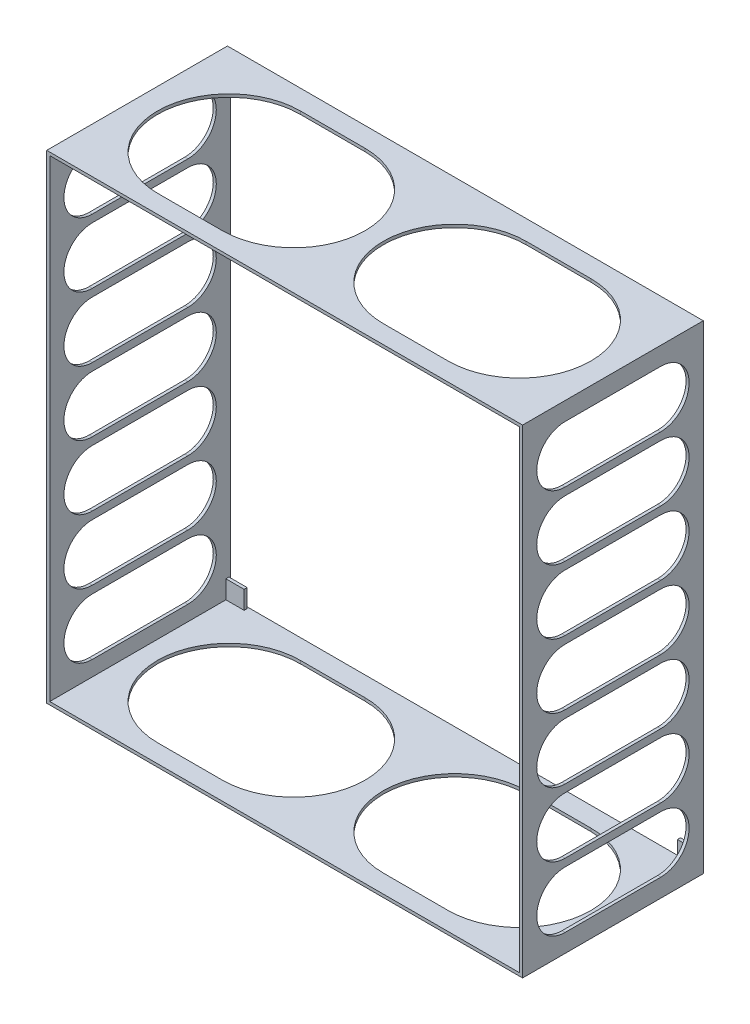
from build123d import *

# Parameters (mm, degrees)
SKETCH1_W               = 313.367
SKETCH1_H               = 315.36
SKETCH1_W_2             = 309.367
SKETCH1_H_2             = 311.36
EXTRUDE_THIN1_DEPTH     = 119
CUT_EXTRUDE1_DEPTH      = 445.128605574
CUT_EXTRUDE1_DEPTH_BACK = 445.128605574
SKETCH3_W               = 2
SKETCH3_H               = 12
BOSS_EXTRUDE1_DEPTH     = 12
SKETCH4_W               = 2
SKETCH4_H               = 12
BOSS_EXTRUDE2_DEPTH     = 12
SKETCH5_W               = 2
SKETCH5_H               = 12
BOSS_EXTRUDE3_DEPTH     = 12
SKETCH6_W               = 2
SKETCH6_H               = 12
BOSS_EXTRUDE4_DEPTH     = 12
CUT_EXTRUDE2_DEPTH      = 392.361567721


with BuildPart() as part:
    # Sketch1 → Extrude-Thin1 (new body)
    with BuildSketch(Plane.XY):
        with Locations((134.6835, -44.32)):
            Rectangle(SKETCH1_W, SKETCH1_H)
        with Locations((134.6835, -44.32)):
            Rectangle(SKETCH1_W_2, SKETCH1_H_2, mode=Mode.SUBTRACT)
    extrude(amount=EXTRUDE_THIN1_DEPTH)

    # Sketch2 → Cut-Extrude1 (cut, two sides: drawn at the far end of the back side and taken through both)
    with BuildSketch(Plane(origin=(0, -200, 0), x_dir=(1, 0, 0), z_dir=(0, 1, 0)).offset(-CUT_EXTRUDE1_DEPTH_BACK)):
        with BuildLine():
            Line((39, -13), (81.6835, -13))
            ThreePointArc((81.6835, -13), (128.6835, -60), (81.6835, -107))
            Line((81.6835, -107), (39, -107))
            ThreePointArc((39, -107), (-8, -60), (39, -13))
        make_face()
        with BuildLine():
            Line((187.6835, -13), (230.367, -13))
            ThreePointArc((230.367, -13), (277.367, -60), (230.367, -107))
            Line((230.367, -107), (187.6835, -107))
            ThreePointArc((187.6835, -107), (140.6835, -60), (187.6835, -13))
        make_face()
    extrude(amount=CUT_EXTRUDE1_DEPTH + CUT_EXTRUDE1_DEPTH_BACK, mode=Mode.SUBTRACT)

    # Sketch3 → Boss-Extrude1 (add)
    with BuildSketch(Plane(origin=(-20, 0, 0), x_dir=(0, 0, -1), z_dir=(1, 0, 0))):
        with Locations((-2, -194)):
            Rectangle(SKETCH3_W, SKETCH3_H)
    extrude(amount=BOSS_EXTRUDE1_DEPTH)

    # Sketch4 → Boss-Extrude2 (add)
    with BuildSketch(Plane(origin=(-20, 0, 0), x_dir=(0, 0, -1), z_dir=(1, 0, 0))):
        with Locations((-2, 105.36)):
            Rectangle(SKETCH4_W, SKETCH4_H)
    extrude(amount=BOSS_EXTRUDE2_DEPTH)

    # Sketch5 → Boss-Extrude3 (add)
    with BuildSketch(Plane.ZY.offset(-289.367)):
        with Locations((2, 105.36)):
            Rectangle(SKETCH5_W, SKETCH5_H)
    extrude(amount=BOSS_EXTRUDE3_DEPTH)

    # Sketch6 → Boss-Extrude4 (add)
    with BuildSketch(Plane.ZY.offset(-289.367)):
        with Locations((2, -194)):
            Rectangle(SKETCH6_W, SKETCH6_H)
    extrude(amount=BOSS_EXTRUDE4_DEPTH)

    # Sketch7 → Cut-Extrude2 (cut, through all)
    with BuildSketch(Plane(origin=(291.367, 0, 0), x_dir=(0, 0, -1), z_dir=(1, 0, 0))):
        with BuildLine():
            Line((-91, 101.36), (-28, 101.36))
            ThreePointArc((-28, 101.36), (-9.331428571, 82.691428571), (-28, 64.022857143))
            Line((-28, 64.022857143), (-91, 64.022857143))
            ThreePointArc((-91, 64.022857143), (-109.668571429, 82.691428571), (-91, 101.36))
        make_face()
        with BuildLine():
            Line((-91, 59.022857143), (-28, 59.022857143))
            ThreePointArc((-28, 59.022857143), (-9.331428571, 40.354285714), (-28, 21.685714286))
            Line((-28, 21.685714286), (-91, 21.685714286))
            ThreePointArc((-91, 21.685714286), (-109.668571429, 40.354285714), (-91, 59.022857143))
        make_face()
        with BuildLine():
            Line((-91, 16.685714286), (-28, 16.685714286))
            ThreePointArc((-28, 16.685714286), (-9.331428571, -1.982857143), (-28, -20.651428571))
            Line((-28, -20.651428571), (-91, -20.651428571))
            ThreePointArc((-91, -20.651428571), (-109.668571429, -1.982857143), (-91, 16.685714286))
        make_face()
        with BuildLine():
            Line((-91, -25.651428571), (-28, -25.651428571))
            ThreePointArc((-28, -25.651428571), (-9.331428571, -44.32), (-28, -62.988571429))
            Line((-28, -62.988571429), (-91, -62.988571429))
            ThreePointArc((-91, -62.988571429), (-109.668571429, -44.32), (-91, -25.651428571))
        make_face()
        with BuildLine():
            Line((-91, -67.988571429), (-28, -67.988571429))
            ThreePointArc((-28, -67.988571429), (-9.331428571, -86.657142857), (-28, -105.325714286))
            Line((-28, -105.325714286), (-91, -105.325714286))
            ThreePointArc((-91, -105.325714286), (-109.668571429, -86.657142857), (-91, -67.988571429))
        make_face()
        with BuildLine():
            Line((-91, -110.325714286), (-28, -110.325714286))
            ThreePointArc((-28, -110.325714286), (-9.331428571, -128.994285714), (-28, -147.662857143))
            Line((-28, -147.662857143), (-91, -147.662857143))
            ThreePointArc((-91, -147.662857143), (-109.668571429, -128.994285714), (-91, -110.325714286))
        make_face()
        with BuildLine():
            Line((-91, -152.662857143), (-28, -152.662857143))
            ThreePointArc((-28, -152.662857143), (-9.331428571, -171.331428571), (-28, -190))
            Line((-28, -190), (-91, -190))
            ThreePointArc((-91, -190), (-109.668571429, -171.331428571), (-91, -152.662857143))
        make_face()
    extrude(amount=-CUT_EXTRUDE2_DEPTH, mode=Mode.SUBTRACT)


solid = part.part
